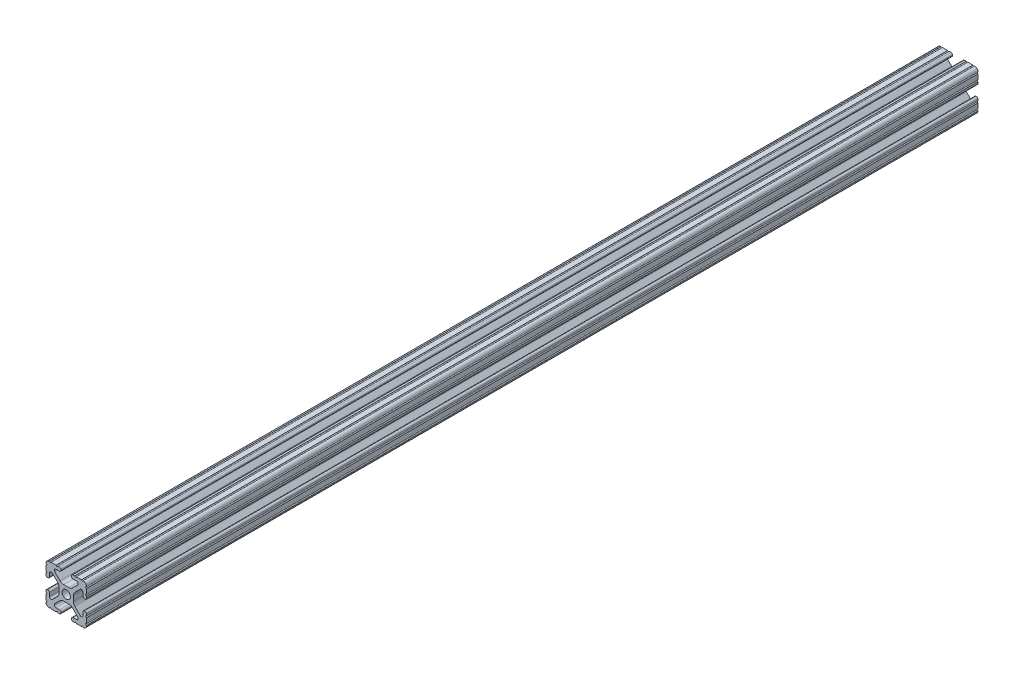
from build123d import *

# Parameters (mm, degrees)
EXTRUDE1_DEPTH      = 0.508
EXTRUDE1_DEPTH_BACK = 558.8
SKETCH1_R           = 2.6035


with BuildPart() as part:
    # Sketch1 → Extrude1 (new, two sides: drawn at the far end of the back side and taken through both)
    with BuildSketch(Plane.XY.offset(-EXTRUDE1_DEPTH_BACK)):
        with BuildLine():
            Line((-7.207036008, 8.724370562), (-3.898272566, 5.423169045))
            ThreePointArc((-3.898272566, 5.423169045), (-2.869120213, 4.736787962), (-1.655778399, 4.4958))
            Line((-1.655778399, 4.4958), (1.655778399, 4.4958))
            ThreePointArc((1.655778399, 4.4958), (2.869120213, 4.736787962), (3.898272566, 5.423169045))
            Line((3.898272566, 5.423169045), (7.207036008, 8.724370562))
            ThreePointArc((7.207036008, 8.724370562), (7.432222385, 9.85140422), (6.476788598, 10.4902))
            Line((6.476788598, 10.4902), (4.287512407, 10.4902))
            ThreePointArc((4.287512407, 10.4902), (3.54574862, 10.79744862), (3.2385, 11.539212407))
            Line((3.2385, 11.539212407), (3.2385, 11.650987593))
            ThreePointArc((3.2385, 11.650987593), (3.54574862, 12.39275138), (4.287512407, 12.7))
            Line((4.287512407, 12.7), (5.317126718, 12.7))
            ThreePointArc((5.317126718, 12.7), (5.825126718, 12.192), (6.333126718, 12.7))
            Line((6.333126718, 12.7), (9.550443118, 12.7))
            ThreePointArc((9.550443118, 12.7), (10.058366869, 12.192000006), (10.566443095, 12.699847501))
            ThreePointArc((10.566443095, 12.699847501), (12.082537762, 12.08250727), (12.699846982, 10.566399977))
            ThreePointArc((12.699846982, 10.566399977), (12.192000006, 10.058323491), (12.7, 9.5504))
            Line((12.7, 9.5504), (12.7, 6.3330836))
            ThreePointArc((12.7, 6.3330836), (12.192, 5.8250836), (12.7, 5.3170836))
            Line((12.7, 5.3170836), (12.7, 4.287469289))
            ThreePointArc((12.7, 4.287469289), (12.39275138, 3.545705502), (11.650987593, 3.238456882))
            Line((11.650987593, 3.238456882), (11.539212407, 3.238456882))
            ThreePointArc((11.539212407, 3.238456882), (10.79744862, 3.545705502), (10.4902, 4.287469289))
            Line((10.4902, 4.287469289), (10.4902, 6.402089023))
            ThreePointArc((10.4902, 6.402089023), (9.856505071, 7.351067942), (8.737131347, 7.129408934))
            Line((8.737131347, 7.129408934), (5.441005833, 3.840816462))
            ThreePointArc((5.441005833, 3.840816462), (4.750877967, 2.809883091), (4.5085, 1.593185507))
            Line((4.5085, 1.593185507), (4.5085, -1.593185507))
            ThreePointArc((4.5085, -1.593185507), (4.750877967, -2.809883091), (5.441005833, -3.840816462))
            Line((5.441005833, -3.840816462), (8.737131347, -7.129408934))
            ThreePointArc((8.737131347, -7.129408934), (9.856505071, -7.351067942), (10.4902, -6.402089023))
            Line((10.4902, -6.402089023), (10.4902, -4.287469289))
            ThreePointArc((10.4902, -4.287469289), (10.79744862, -3.545705502), (11.539212407, -3.238456882))
            Line((11.539212407, -3.238456882), (11.650987593, -3.238456882))
            ThreePointArc((11.650987593, -3.238456882), (12.39275138, -3.545705502), (12.7, -4.287469289))
            Line((12.7, -4.287469289), (12.7, -5.3170836))
            ThreePointArc((12.7, -5.3170836), (12.192, -5.8250836), (12.7, -6.3330836))
            Line((12.7, -6.3330836), (12.7, -9.5504))
            ThreePointArc((12.7, -9.5504), (12.192000006, -10.058323491), (12.699846982, -10.566399977))
            ThreePointArc((12.699846982, -10.566399977), (12.082537762, -12.08250727), (10.566443095, -12.699847501))
            ThreePointArc((10.566443095, -12.699847501), (10.058366869, -12.192000006), (9.550443118, -12.7))
            Line((9.550443118, -12.7), (6.333126718, -12.7))
            ThreePointArc((6.333126718, -12.7), (5.825126718, -12.192), (5.317126718, -12.7))
            Line((5.317126718, -12.7), (4.287512407, -12.7))
            ThreePointArc((4.287512407, -12.7), (3.54574862, -12.39275138), (3.2385, -11.650987593))
            Line((3.2385, -11.650987593), (3.2385, -11.539212407))
            ThreePointArc((3.2385, -11.539212407), (3.54574862, -10.79744862), (4.287512407, -10.4902))
            Line((4.287512407, -10.4902), (6.416408329, -10.4902))
            ThreePointArc((6.416408329, -10.4902), (7.41473083, -9.822813117), (7.179650497, -8.645192506))
            Line((7.179650497, -8.645192506), (3.952270251, -5.423690499))
            ThreePointArc((3.952270251, -5.423690499), (2.922936451, -4.736929036), (1.709253557, -4.4958))
            Line((1.709253557, -4.4958), (-1.709253557, -4.4958))
            ThreePointArc((-1.709253557, -4.4958), (-2.922936451, -4.736929036), (-3.952270251, -5.423690499))
            Line((-3.952270251, -5.423690499), (-7.179650497, -8.645192506))
            ThreePointArc((-7.179650497, -8.645192506), (-7.41473083, -9.822813117), (-6.416408329, -10.4902))
            Line((-6.416408329, -10.4902), (-4.287512407, -10.4902))
            ThreePointArc((-4.287512407, -10.4902), (-3.54574862, -10.79744862), (-3.2385, -11.539212407))
            Line((-3.2385, -11.539212407), (-3.2385, -11.650987593))
            ThreePointArc((-3.2385, -11.650987593), (-3.54574862, -12.39275138), (-4.287512407, -12.7))
            Line((-4.287512407, -12.7), (-5.317126718, -12.7))
            ThreePointArc((-5.317126718, -12.7), (-5.825126718, -12.192), (-6.333126718, -12.7))
            Line((-6.333126718, -12.7), (-9.550443118, -12.7))
            ThreePointArc((-9.550443118, -12.7), (-10.058366869, -12.192000006), (-10.566443095, -12.699847501))
            ThreePointArc((-10.566443095, -12.699847501), (-12.082537762, -12.08250727), (-12.699846982, -10.566399977))
            ThreePointArc((-12.699846982, -10.566399977), (-12.192000006, -10.058323491), (-12.7, -9.5504))
            Line((-12.7, -9.5504), (-12.7, -6.3330836))
            ThreePointArc((-12.7, -6.3330836), (-12.192, -5.8250836), (-12.7, -5.3170836))
            Line((-12.7, -5.3170836), (-12.7, -4.287469289))
            ThreePointArc((-12.7, -4.287469289), (-12.39275138, -3.545705502), (-11.650987593, -3.238456882))
            Line((-11.650987593, -3.238456882), (-11.539212407, -3.238456882))
            ThreePointArc((-11.539212407, -3.238456882), (-10.79744862, -3.545705502), (-10.4902, -4.287469289))
            Line((-10.4902, -4.287469289), (-10.4902, -6.402089023))
            ThreePointArc((-10.4902, -6.402089023), (-9.856505071, -7.351067942), (-8.737131347, -7.129408934))
            Line((-8.737131347, -7.129408934), (-5.441005833, -3.840816462))
            ThreePointArc((-5.441005833, -3.840816462), (-4.750877967, -2.809883091), (-4.5085, -1.593185507))
            Line((-4.5085, -1.593185507), (-4.5085, 1.593185507))
            ThreePointArc((-4.5085, 1.593185507), (-4.750877967, 2.809883091), (-5.441005833, 3.840816462))
            Line((-5.441005833, 3.840816462), (-8.737131347, 7.129408934))
            ThreePointArc((-8.737131347, 7.129408934), (-9.856505071, 7.351067942), (-10.4902, 6.402089023))
            Line((-10.4902, 6.402089023), (-10.4902, 4.287469289))
            ThreePointArc((-10.4902, 4.287469289), (-10.79744862, 3.545705502), (-11.539212407, 3.238456882))
            Line((-11.539212407, 3.238456882), (-11.650987593, 3.238456882))
            ThreePointArc((-11.650987593, 3.238456882), (-12.39275138, 3.545705502), (-12.7, 4.287469289))
            Line((-12.7, 4.287469289), (-12.7, 5.3170836))
            ThreePointArc((-12.7, 5.3170836), (-12.192, 5.8250836), (-12.7, 6.3330836))
            Line((-12.7, 6.3330836), (-12.7, 9.5504))
            ThreePointArc((-12.7, 9.5504), (-12.192000006, 10.058323491), (-12.699846982, 10.566399977))
            ThreePointArc((-12.699846982, 10.566399977), (-12.082537762, 12.08250727), (-10.566443095, 12.699847501))
            ThreePointArc((-10.566443095, 12.699847501), (-10.058366869, 12.192000006), (-9.550443118, 12.7))
            Line((-9.550443118, 12.7), (-6.333126718, 12.7))
            ThreePointArc((-6.333126718, 12.7), (-5.825126718, 12.192), (-5.317126718, 12.7))
            Line((-5.317126718, 12.7), (-4.287512407, 12.7))
            ThreePointArc((-4.287512407, 12.7), (-3.54574862, 12.39275138), (-3.2385, 11.650987593))
            Line((-3.2385, 11.650987593), (-3.2385, 11.539212407))
            ThreePointArc((-3.2385, 11.539212407), (-3.54574862, 10.79744862), (-4.287512407, 10.4902))
            Line((-4.287512407, 10.4902), (-6.476788598, 10.4902))
            ThreePointArc((-6.476788598, 10.4902), (-7.432222385, 9.85140422), (-7.207036008, 8.724370562))
        make_face()
        Circle(SKETCH1_R, mode=Mode.SUBTRACT)
    extrude(amount=EXTRUDE1_DEPTH + EXTRUDE1_DEPTH_BACK)


solid = part.part
